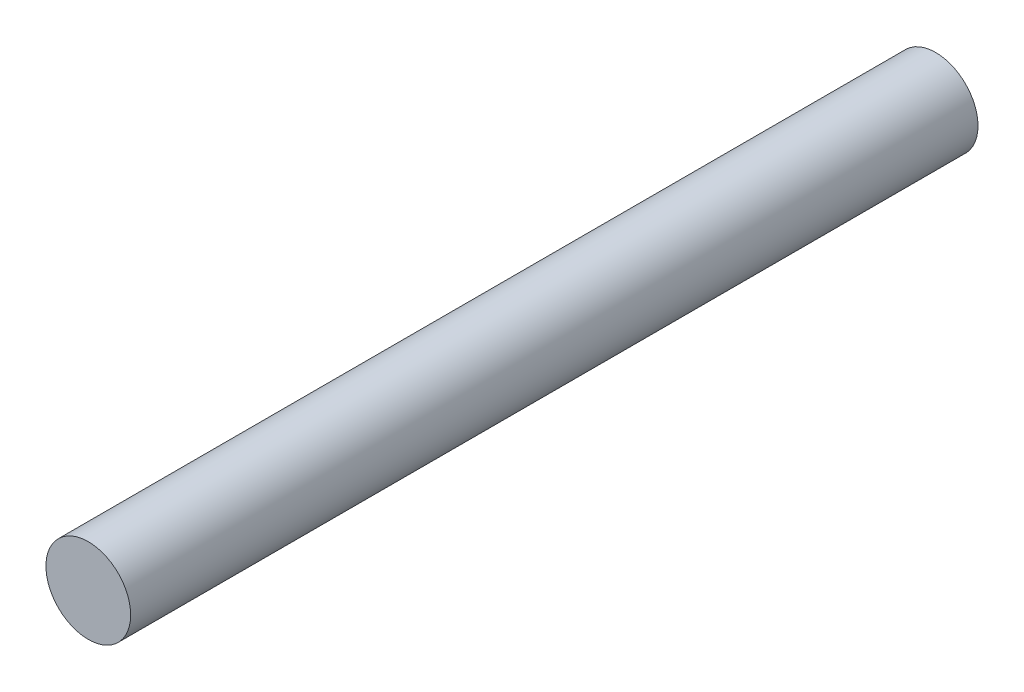
from build123d import *

# Parameters (mm, degrees)
SKETCH1_R           = 0.75
BOSS_EXTRUDE1_DEPTH = 15


with BuildPart() as part:
    # Sketch1 → Boss-Extrude1 (new body)
    with BuildSketch(Plane.XY):
        Circle(SKETCH1_R)
    extrude(amount=BOSS_EXTRUDE1_DEPTH)


solid = part.part
